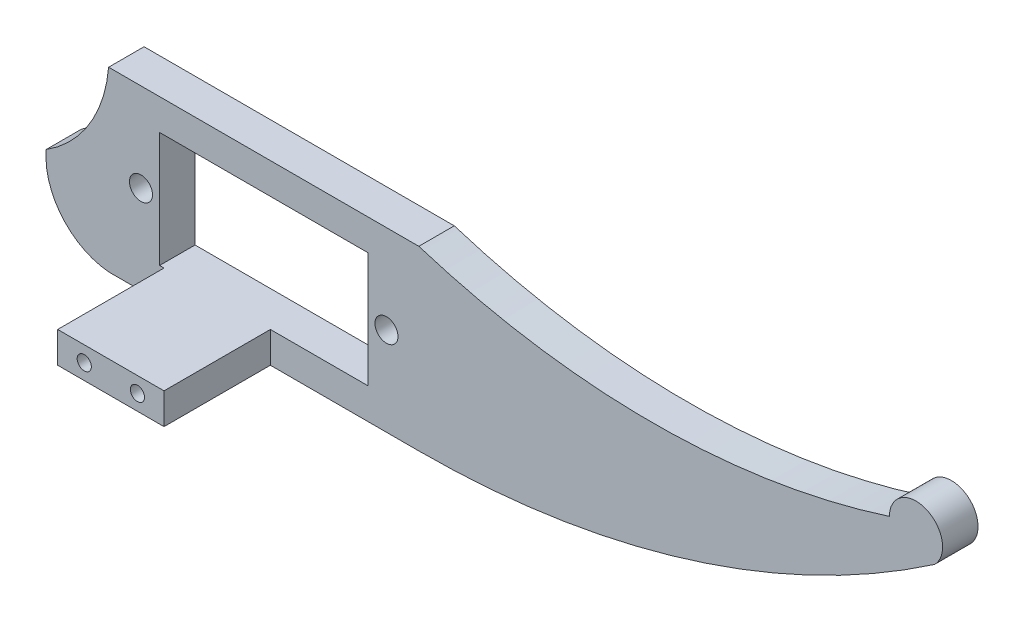
from build123d import *

# Parameters (mm, degrees)
SKETCH1_W           = 23.5
SKETCH1_H           = 13
BOSS_EXTRUDE1_DEPTH = 4
SKETCH4_W           = 12
SKETCH4_H           = 3.5
BOSS_EXTRUDE3_DEPTH = 12
SKETCH6_R           = 1.3
CUT_EXTRUDE3_DEPTH  = 4
SKETCH7_R           = 0.8
CUT_EXTRUDE4_DEPTH  = 3


with BuildPart() as part:
    # Sketch1 → Boss-Extrude1 (new body)
    with BuildSketch(Plane.XY):
        with BuildLine():
            Line((24.860467777, 7.362362669), (-10.139532223, 7.362362669))
            ThreePointArc((-10.139532223, 7.362362669), (-12.294111981, 0.751764817), (-17.178188495, -4.196771785))
            ThreePointArc((-17.178188495, -4.196771785), (-15.407020853, -9.874958003), (-10.139532223, -12.637637331))
            Line((-10.139532223, -12.637637331), (24.860467777, -12.637637331))
            ThreePointArc((24.860467777, -12.637637331), (54.82087059, -8.185603487), (82.192202879, 4.785769252))
            ThreePointArc((82.192202879, 4.785769252), (82.614789286, 5.070273598), (83.035963889, 5.356863806))
            ThreePointArc((83.035963889, 5.356863806), (82.132298227, 10.279823625), (77.956940726, 7.519654292))
            ThreePointArc((77.956940726, 7.519654292), (51.420959061, 3.304188228), (24.860467777, 7.362362669))
        make_face()
        with Locations((7.360467777, -2.637637331)):
            Rectangle(SKETCH1_W, SKETCH1_H, mode=Mode.SUBTRACT)
    extrude(amount=BOSS_EXTRUDE1_DEPTH)

    # Sketch4 → Boss-Extrude3 (add)
    with BuildSketch(Plane(origin=(0, 0, 4), x_dir=(-1, 0, 0), z_dir=(0, 0, -1))):
        with Locations((-2.110467777, -10.887637331)):
            Rectangle(SKETCH4_W, SKETCH4_H)
    extrude(amount=-BOSS_EXTRUDE3_DEPTH)

    # Sketch6 → Cut-Extrude3 (cut)
    with BuildSketch(Plane.XY.offset(4)):
        with Locations((21.210467777, -2.637637331)):
            Circle(SKETCH6_R)
        with Locations((-6.489532223, -2.637637331)):
            Circle(SKETCH6_R)
    extrude(amount=-CUT_EXTRUDE3_DEPTH, mode=Mode.SUBTRACT)

    # Sketch7 → Cut-Extrude4 (cut)
    with BuildSketch(Plane.XY.offset(16)):
        with Locations((5.110467777, -10.887637331)):
            Circle(SKETCH7_R)
        with Locations((-0.889532223, -10.887637331)):
            Circle(SKETCH7_R)
    extrude(amount=-CUT_EXTRUDE4_DEPTH, mode=Mode.SUBTRACT)


solid = part.part
